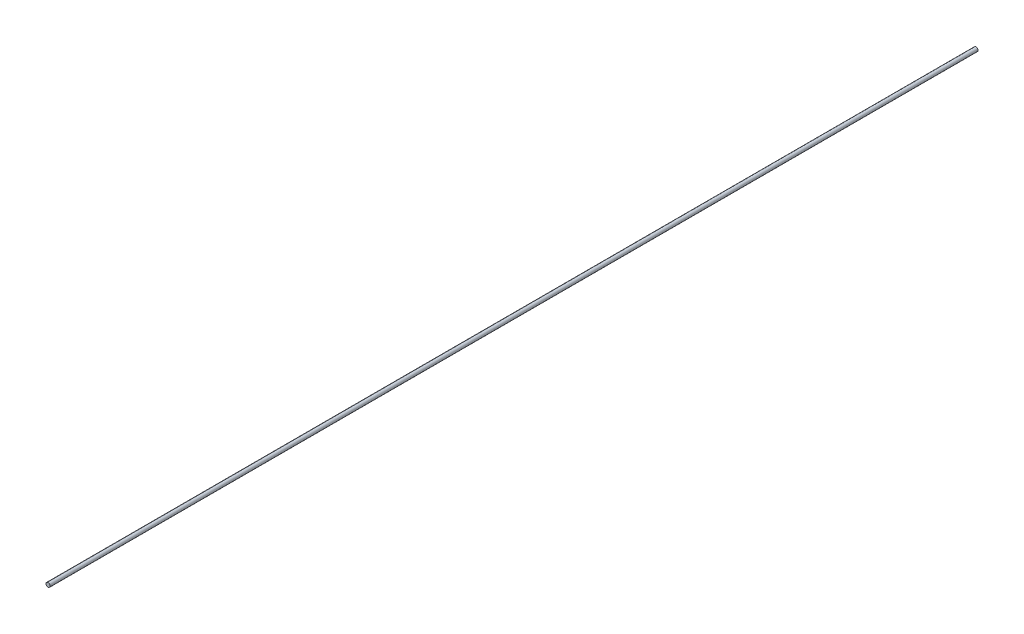
from build123d import *

# Parameters (mm, degrees)
SKETCH1_R           = 2
BOSS_EXTRUDE1_DEPTH = 915


with BuildPart() as part:
    # Sketch1 → Boss-Extrude1 (new body)
    with BuildSketch(Plane.XY):
        with Locations(Location((0, 0, 0), (0, 0, 180))):
            Circle(SKETCH1_R)
    extrude(amount=BOSS_EXTRUDE1_DEPTH)


solid = part.part
